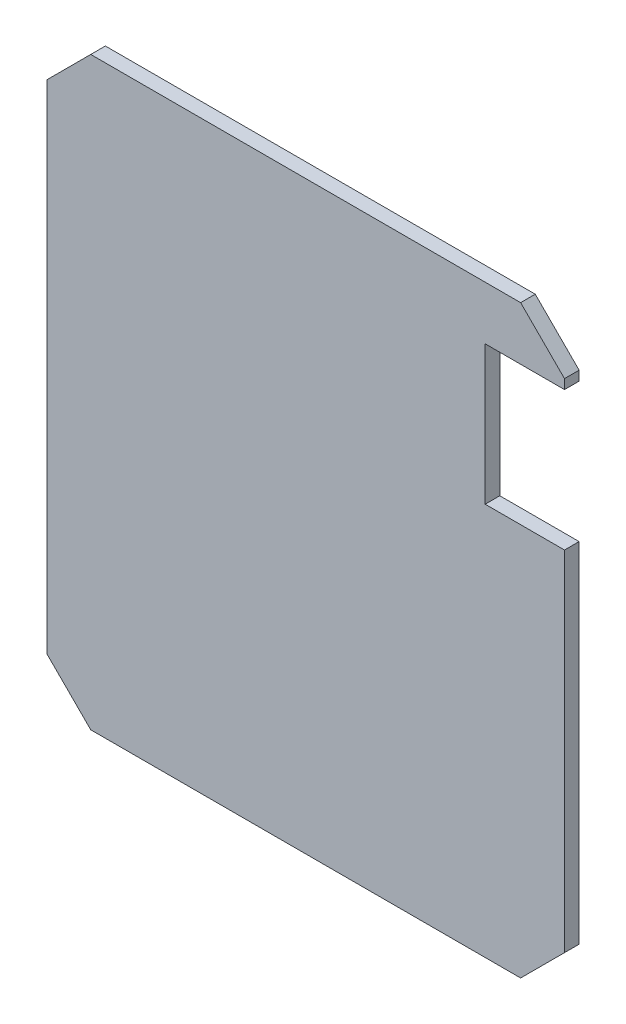
from build123d import *

# Parameters (mm, degrees)
BOSS_EXTRUDE1_DEPTH = 1
SKETCH4_W           = 5.425280566
SKETCH4_H           = 9.499999808
CUT_EXTRUDE1_DEPTH  = 27.726204369


with BuildPart() as part:
    # Sketch3 → Boss-Extrude1 (new body)
    with BuildSketch(Plane.XY):
        Polygon((-14.7, 20), (14.7, 20), (17.7, 17), (17.7, -17), (14.7, -20), (-14.7, -20), (-17.7, -17), (-17.7, 17), align=None)
    extrude(amount=BOSS_EXTRUDE1_DEPTH)

    # Sketch4 → Cut-Extrude1 (cut, through all)
    with BuildSketch(Plane.XY.offset(1)):
        with Locations((14.987359717, 11.599023368)):
            Rectangle(SKETCH4_W, SKETCH4_H)
    extrude(amount=-CUT_EXTRUDE1_DEPTH, mode=Mode.SUBTRACT)


solid = part.part
